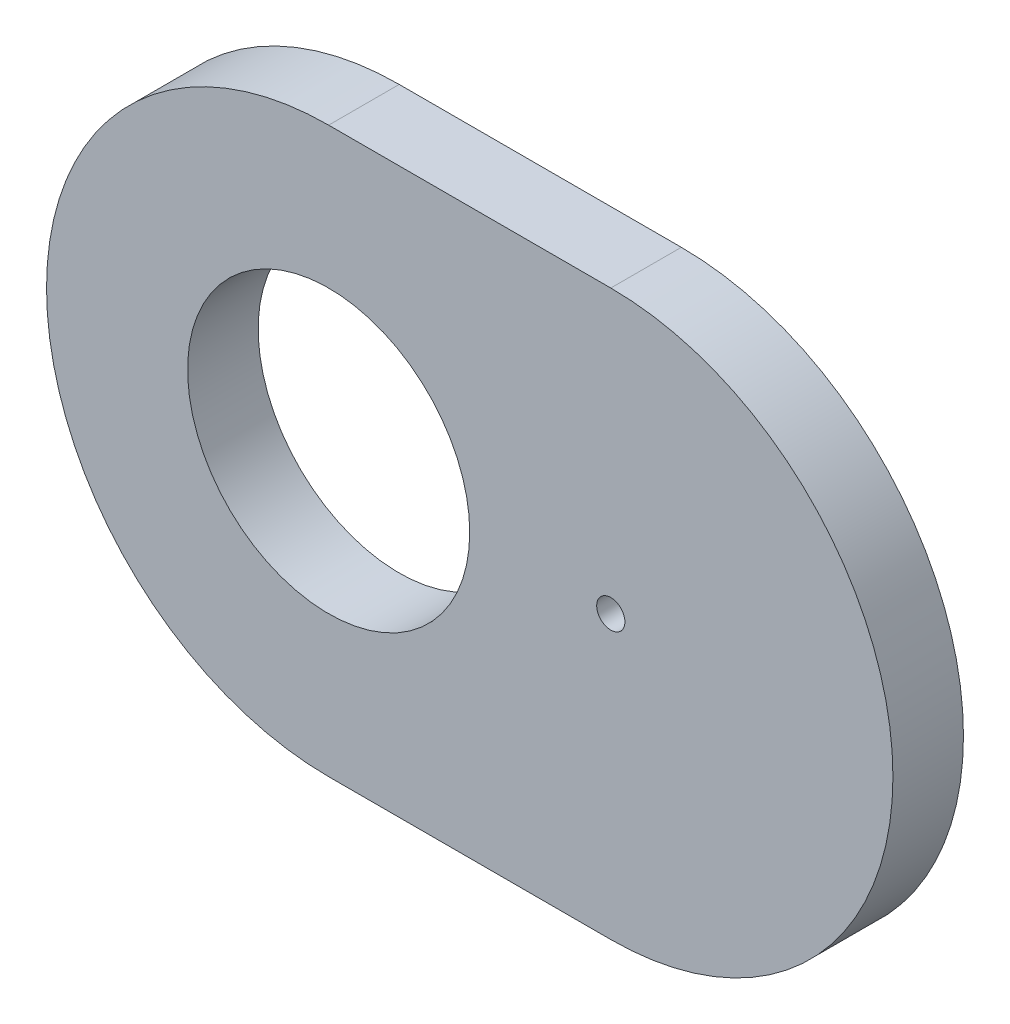
from build123d import *

# Parameters (mm, degrees)
BOSS_EXTRUDE1_DEPTH = 6.35
SKETCH3_6_R         = 12.7
CUT_EXTRUDE1_DEPTH  = 6.35
SKETCH3_9_R         = 1.27
CUT_EXTRUDE5_DEPTH  = 6.35


with BuildPart() as part:
    # Sketch3 → Boss-Extrude1 (new body)
    with BuildSketch(Plane.XY):
        with BuildLine():
            Line((-1.03476248, -23.06540758), (24.36523752, -23.06540758))
            ThreePointArc((24.36523752, -23.06540758), (49.76523752, -48.46540758), (24.36523752, -73.86540758))
            Line((24.36523752, -73.86540758), (-1.03476248, -73.86540758))
            ThreePointArc((-1.03476248, -73.86540758), (-26.43476248, -48.46540758), (-1.03476248, -23.06540758))
        make_face()
    extrude(amount=BOSS_EXTRUDE1_DEPTH)

    # Sketch3<6> → Cut-Extrude1 (cut)
    with BuildSketch(Plane.XY):
        with Locations((-1.03476248, -48.46540758)):
            Circle(SKETCH3_6_R)
    extrude(amount=CUT_EXTRUDE1_DEPTH, mode=Mode.SUBTRACT)

    # Sketch3<9> → Cut-Extrude5 (cut)
    with BuildSketch(Plane.XY):
        with Locations((24.36523752, -48.46540758)):
            Circle(SKETCH3_9_R)
    extrude(amount=CUT_EXTRUDE5_DEPTH, mode=Mode.SUBTRACT)


solid = part.part
